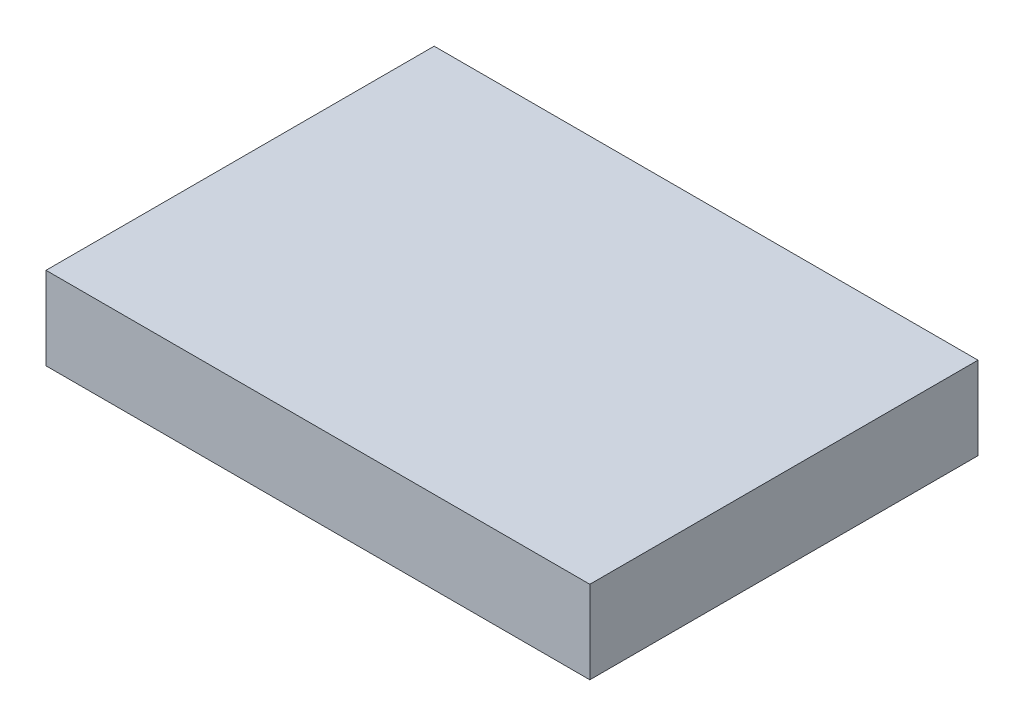
from build123d import *

# Parameters (mm, degrees)
SKETCH1_W           = 70.104
SKETCH1_H           = 50.038
BOSS_EXTRUDE1_DEPTH = 10.668


with BuildPart() as part:
    # Sketch1 → Boss-Extrude1 (new body)
    with BuildSketch(Plane(origin=(0, 0, 0), x_dir=(1, 0, 0), z_dir=(0, 1, 0))):
        Rectangle(SKETCH1_W, SKETCH1_H)
    extrude(amount=BOSS_EXTRUDE1_DEPTH)


solid = part.part
